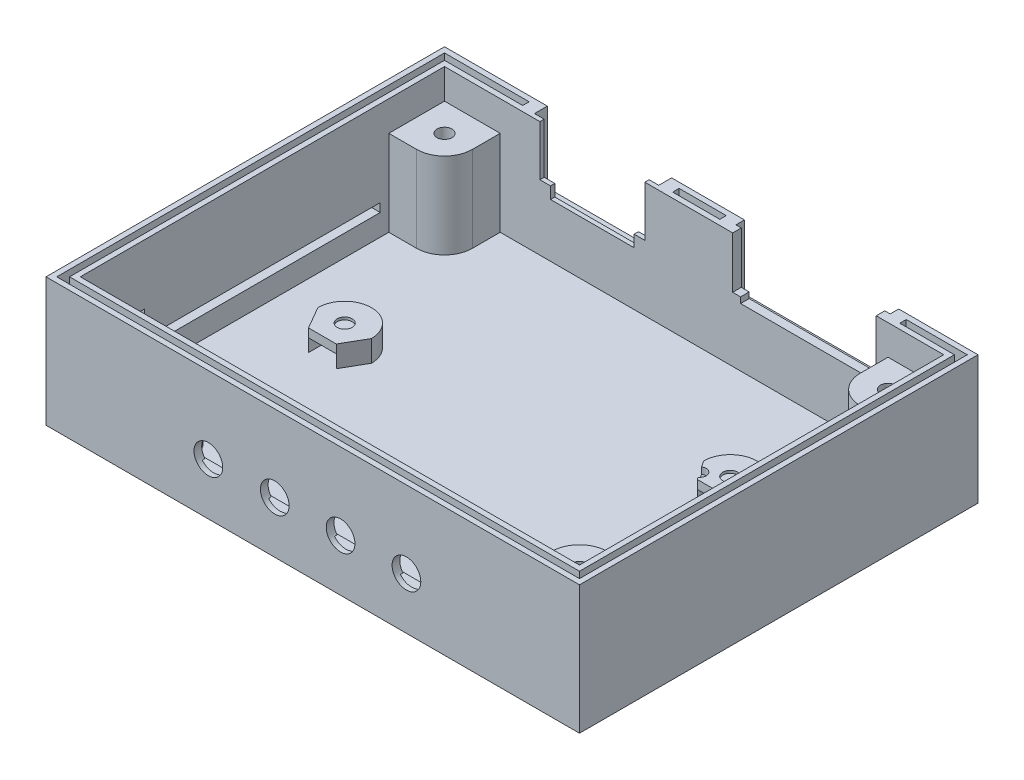
from build123d import *

# Parameters (mm, degrees)
SKETCH_1_W             = 116.5
SKETCH_1_H             = 85
EXTRUDE_1_DEPTH        = 3
EXTRUDE_2_DEPTH        = 3
EXTRUDE_3_DEPTH        = 2
SKETCH_5_W             = 2
SKETCH_5_H             = 5.464101615
SKETCH_5_W_2           = 1.5
SKETCH_5_H_2           = 1.5
CUT_EXTRUDE_1_DEPTH    = 1.5
SKETCH_211_R           = 1.75
CUT_EXTRUDE_17_DEPTH   = 0.6
EXTRUDE_1_2_DEPTH      = 27
EXTRUDE_1_2_DEPTH_BACK = 3
SKETCH_6_W             = 124.5
SKETCH_6_H             = 93
SKETCH_6_W_2           = 116.5
SKETCH_6_H_2           = 85
CUT_EXTRUDE_6_DEPTH    = 3
CUT_EXTRUDE_1_2_DEPTH  = 2
CUT_EXTRUDE_7_REACH    = 114.677
SKETCH_30_R            = 3.35
SKETCH_31_W            = 13.2
SKETCH_31_H            = 7
CUT_EXTRUDE_8_DEPTH    = 2.2
SWEEP_1_PROFILE_R      = 3.85
SWEEP_3_PROFILE_R      = 3.85
SWEEP_4_PROFILE_R      = 3.85
SWEEP_5_PROFILE_R      = 3.85
CUT_EXTRUDE_11_REACH   = 134.599
SKETCH_121_R           = 3.35
SWEEP_6_PROFILE_R      = 3.35
CUT_EXTRUDE_2_DEPTH    = 8
SKETCH_149_W           = 29
SKETCH_149_H           = 16.5
CUT_EXTRUDE_12_DEPTH   = 3
CUT_EXTRUDE_13_DEPTH   = 1
SKETCH_191_W           = 36
SKETCH_191_H           = 15
CUT_EXTRUDE_14_DEPTH   = 2
CUT_EXTRUDE_15_DEPTH   = 2
EXTRUDE_4_DEPTH        = 20
SKETCH_194_R           = 1.75
CUT_EXTRUDE_16_DEPTH   = 10
SKETCH_238_W           = 11
SKETCH_238_H           = 1.5
CUT_EXTRUDE_3_DEPTH    = 3


with BuildPart() as part:
    # Эскиз1 → Extrude 1 (new body)
    with BuildSketch(Plane(origin=(0, 0, 0), x_dir=(1, 0, 0), z_dir=(0, 1, 0))):
        Rectangle(SKETCH_1_W, SKETCH_1_H)
    extrude(amount=EXTRUDE_1_DEPTH)

    # Эскиз3 → Бобышка-Вытянуть2 (add)
    with BuildSketch(Plane(origin=(0, 3, 0), x_dir=(1, 0, 0), z_dir=(0, 1, 0))):
        Polygon((-46.3, -40.5), (-46.3, -42.5), (-42.145299462, -42.5), (-43.3, -40.5), (-43.3, -35.303847577), align=None)
        Polygon((-33.8, -42.5), (-33.8, -40.5), (-36.8, -35.303847577), (-36.8, -40.5), (-37.954700538, -42.5), align=None)
        Polygon((39.2, -40.5), (39.2, -35.303847577), (42.2, -40.5), (42.2, -42.5), (38.045299462, -42.5), align=None)
        with BuildLine():
            Line((-36.8, 1), (-38.425, 3.814582562))
            Line((-38.425, 3.814582562), (-41.675, 3.814582562))
            Line((-41.675, 3.814582562), (-43.3, 1))
            Line((-43.3, 1), (-43.3, -4.196152423))
            Line((-43.3, -4.196152423), (-46.3, 1))
            ThreePointArc((-46.3, 1), (-40.05, 7.25), (-33.8, 1))
            Line((-33.8, 1), (-36.8, -4.196152423))
            Line((-36.8, -4.196152423), (-36.8, 1))
        make_face()
        Polygon((29.7, -40.5), (29.7, -42.5), (33.854700538, -42.5), (32.7, -40.5), (32.7, -35.303847577), align=None)
        with BuildLine():
            Line((39.2, 14.999999964), (37.386138315, 17.696739832))
            Line((37.386138315, 17.696739832), (34.513861685, 17.696739832))
            Line((34.513861685, 17.696739832), (32.7, 14.999999964))
            Line((32.7, 14.999999964), (32.7, 10.539781588))
            Line((32.7, 10.539781588), (29.7, 14.999999964))
            ThreePointArc((29.7, 14.999999964), (35.95, 21.25), (42.2, 14.999999964))
            Line((42.2, 14.999999964), (39.2, 10.539781588))
            Line((39.2, 10.539781588), (39.2, 14.999999964))
        make_face()
    extrude(amount=EXTRUDE_2_DEPTH)

    # Эскиз4 → Бобышка-Вытянуть3 (add)
    with BuildSketch(Plane(origin=(0, 6, 0), x_dir=(1, 0, 0), z_dir=(0, 1, 0))):
        Polygon((-33.8, -40.5), (-36.8, -35.303847577), (-43.3, -35.303847577), (-46.3, -40.5), (-46.3, -42.5), (-33.8, -42.5), align=None)
        with BuildLine():
            Line((-46.3, 1), (-43.3, -4.196152423))
            Line((-43.3, -4.196152423), (-36.8, -4.196152423))
            Line((-36.8, -4.196152423), (-33.8, 1))
            ThreePointArc((-33.8, 1), (-40.05, 7.25), (-46.3, 1))
        make_face()
        with BuildLine():
            Line((29.7, 14.999999964), (32.7, 10.539781588))
            Line((32.7, 10.539781588), (39.2, 10.539781588))
            Line((39.2, 10.539781588), (42.2, 14.999999964))
            ThreePointArc((42.2, 14.999999964), (35.95, 21.249999964), (29.7, 14.999999964))
        make_face()
        Polygon((29.7, -40.5), (29.7, -42.5), (42.2, -42.5), (42.2, -40.5), (39.2, -35.303847577), (32.7, -35.303847577), align=None)
    extrude(amount=EXTRUDE_3_DEPTH)

    # Эскиз5 → Cut-Extrude 1 (cut)
    with BuildSketch(Plane(origin=(0, 8, 0), x_dir=(1, 0, 0), z_dir=(0, 1, 0))):
        with Locations((-34.8, -39.767949192)):
            Rectangle(SKETCH_5_W, SKETCH_5_H)
        with Locations((36.45, -36.053847577)):
            Rectangle(SKETCH_5_W_2, SKETCH_5_H_2)
        with BuildLine():
            Line((30.66558225, 13.564430732), (32.339916158, 11.075132444))
            ThreePointArc((32.339916158, 11.075132444), (32.747398348, 13.156948542), (30.66558225, 13.564430732))
        make_face()
    extrude(amount=-CUT_EXTRUDE_1_DEPTH, mode=Mode.SUBTRACT)

    # Эскиз211 → Вырез-Вытянуть17 (cut)
    with BuildSketch(Plane(origin=(0, 8, 0), x_dir=(1, 0, 0), z_dir=(0, 1, 0))):
        with Locations(Location((-40.05, 1, 0), (0, 0, 270))):
            Circle(SKETCH_211_R)
        with Locations(Location((35.95, 15, 0), (0, 0, 270))):
            Circle(SKETCH_211_R)
        with Locations(Location((35.95, -40.5, 0), (0, 0, 270))):
            Circle(SKETCH_211_R)
        with Locations(Location((-40.05, -40.5, 0), (0, 0, 270))):
            Circle(SKETCH_211_R)
    extrude(amount=-CUT_EXTRUDE_17_DEPTH, mode=Mode.SUBTRACT)

    # Эскиз6 → Extrude 1 2 (add, two sides: drawn at the far end of the back side and taken through both)
    with BuildSketch(Plane(origin=(0, 3, 0), x_dir=(1, 0, 0), z_dir=(0, 1, 0)).offset(-EXTRUDE_1_2_DEPTH_BACK)):
        Rectangle(SKETCH_6_W, SKETCH_6_H)
        Rectangle(SKETCH_6_W_2, SKETCH_6_H_2, mode=Mode.SUBTRACT)
    extrude(amount=EXTRUDE_1_2_DEPTH + EXTRUDE_1_2_DEPTH_BACK)

    # Эскиз29 → Вырез-Вытянуть6 (cut)
    with BuildSketch(Plane(origin=(0, 3, 0), x_dir=(1, 0, 0), z_dir=(0, 1, 0))):
        Polygon((-36.8, -40.5), (-38.425, -37.685417438), (-41.675, -37.685417438), (-43.3, -40.5), (-41.675, -43.314582562), (-38.425, -43.314582562), align=None)
        Polygon((39.2, -40.5), (37.575, -37.685417438), (34.325, -37.685417438), (32.7, -40.5), (34.325, -43.314582562), (37.575, -43.314582562), align=None)
    extrude(amount=CUT_EXTRUDE_6_DEPTH, mode=Mode.SUBTRACT)

    # Эскиз9 → Cut-Extrude 1 2 (cut)
    with BuildSketch(Plane(origin=(0, 8, 0), x_dir=(1, 0, 0), z_dir=(0, 1, 0))):
        Polygon((-58.25, 27.5), (-58.25, -42.5), (46.75, -42.5), (46.75, -45.3), (-61.05, -45.3), (-61.05, 27.5), align=None)
    extrude(amount=CUT_EXTRUDE_1_2_DEPTH, mode=Mode.SUBTRACT)

    # Вырез-Вытянуть7: up to this face of the body (flat: up to its plane)
    cut_extrude_7_end = Plane(part.part.faces().sort_by_distance((0, 15, 46.5))[0])
    # Эскиз30 → Вырез-Вытянуть7 (cut, up to the picked face)
    with BuildSketch(Plane(origin=(0, 0, 42.5), x_dir=(-1, 0, 0), z_dir=(0, 0, -1)), mode=Mode.PRIVATE) as cut_extrude_7_sk1:
        with Locations(Location((24.363, 12.1, 0), (0, 0, 321.180745817))):
            Circle(SKETCH_30_R)
    cut_extrude_7_tool1 = split(extrude(cut_extrude_7_sk1.sketch, amount=-CUT_EXTRUDE_7_REACH, mode=Mode.PRIVATE), bisect_by=cut_extrude_7_end, keep=Keep.BOTH, mode=Mode.PRIVATE)
    # Эскиз30 → Вырез-Вытянуть7 (cut, up to the picked face)
    with BuildSketch(Plane(origin=(0, 0, 42.5), x_dir=(-1, 0, 0), z_dir=(0, 0, -1)), mode=Mode.PRIVATE) as cut_extrude_7_sk2:
        with Locations(Location((8.869, 12.1, 0), (0, 0, 321.180745817))):
            Circle(SKETCH_30_R)
    cut_extrude_7_tool2 = split(extrude(cut_extrude_7_sk2.sketch, amount=-CUT_EXTRUDE_7_REACH, mode=Mode.PRIVATE), bisect_by=cut_extrude_7_end, keep=Keep.BOTH, mode=Mode.PRIVATE)
    # Эскиз30 → Вырез-Вытянуть7 (cut, up to the picked face)
    with BuildSketch(Plane(origin=(0, 0, 42.5), x_dir=(-1, 0, 0), z_dir=(0, 0, -1)), mode=Mode.PRIVATE) as cut_extrude_7_sk3:
        with Locations(Location((-6.498, 12.1, 0), (0, 0, 321.180745817))):
            Circle(SKETCH_30_R)
    cut_extrude_7_tool3 = split(extrude(cut_extrude_7_sk3.sketch, amount=-CUT_EXTRUDE_7_REACH, mode=Mode.PRIVATE), bisect_by=cut_extrude_7_end, keep=Keep.BOTH, mode=Mode.PRIVATE)
    # Эскиз30 → Вырез-Вытянуть7 (cut, up to the picked face)
    with BuildSketch(Plane(origin=(0, 0, 42.5), x_dir=(-1, 0, 0), z_dir=(0, 0, -1)), mode=Mode.PRIVATE) as cut_extrude_7_sk4:
        with Locations(Location((-21.865, 12.1, 0), (0, 0, 321.180745817))):
            Circle(SKETCH_30_R)
    cut_extrude_7_tool4 = split(extrude(cut_extrude_7_sk4.sketch, amount=-CUT_EXTRUDE_7_REACH, mode=Mode.PRIVATE), bisect_by=cut_extrude_7_end, keep=Keep.BOTH, mode=Mode.PRIVATE)
    add(cut_extrude_7_tool1.solids().sort_by(Axis((-24.363, 12.1, 42.5), (0, 0, 1)))[0], mode=Mode.SUBTRACT)
    add(cut_extrude_7_tool2.solids().sort_by(Axis((-8.869, 12.1, 42.5), (0, 0, 1)))[0], mode=Mode.SUBTRACT)
    add(cut_extrude_7_tool3.solids().sort_by(Axis((6.498, 12.1, 42.5), (0, 0, 1)))[0], mode=Mode.SUBTRACT)
    add(cut_extrude_7_tool4.solids().sort_by(Axis((21.865, 12.1, 42.5), (0, 0, 1)))[0], mode=Mode.SUBTRACT)

    # Эскиз31 → Вырез-Вытянуть8 (cut)
    with BuildSketch(Plane(origin=(0, 0, 42.5), x_dir=(-1, 0, 0), z_dir=(0, 0, -1))):
        with Locations((24.363, 12.1)):
            Rectangle(SKETCH_31_W, SKETCH_31_H)
        with Locations((8.869, 12.1)):
            Rectangle(SKETCH_31_W, SKETCH_31_H)
        with Locations((-6.498, 12.1)):
            Rectangle(SKETCH_31_W, SKETCH_31_H)
        with Locations((-21.865, 12.1)):
            Rectangle(SKETCH_31_W, SKETCH_31_H)
    extrude(amount=-CUT_EXTRUDE_8_DEPTH, mode=Mode.SUBTRACT)

    # Вырез-По траектории1: sweep along a curve in space
    with BuildLine() as sweep_1_path:
        Line((-24.363, 12.1, 44.57), (-18.462212018, 12.1, 34.349535411))
    # Вырез-По траектории1 profile (on start of the path) → Вырез-По траектории1 (sweep, cut)
    with BuildSketch(Plane(origin=(-24.363, 12.1, 44.57), x_dir=(-0.8660254037844366, 0, -0.5000000000000037), z_dir=(0.5000000000000037, 0, -0.8660254037844366))):
        Circle(SWEEP_1_PROFILE_R)
    sweep(path=sweep_1_path.line, mode=Mode.SUBTRACT)

    # Вырез-По траектории3: sweep along a curve in space
    with BuildLine() as sweep_3_path:
        add(Edge.make_bspline(
            [(-8.869, 12.1, 44.57), (-2.482209352, 12.1, 33.507754101)],
            knots=[0, 0, 1, 1], degree=1))
    # Вырез-По траектории3 profile (on start of the path) → Вырез-По траектории3 (sweep, cut)
    with BuildSketch(Plane(origin=(-8.869, 12.1, 44.57), x_dir=(-0.8660254037844368, 0, -0.5000000000000033), z_dir=(0.5000000000000033, 0, -0.8660254037844368))):
        Circle(SWEEP_3_PROFILE_R)
    sweep(path=sweep_3_path.line, mode=Mode.SUBTRACT)

    # Вырез-По траектории4: sweep along a curve in space
    with BuildLine() as sweep_4_path:
        add(Edge.make_bspline(
            [(6.498, 12.1, 44.57), (11.45564145, 12.1, 35.983113122)],
            knots=[0, 0, 1, 1], degree=1))
    # Вырез-По траектории4 profile (on start of the path) → Вырез-По траектории4 (sweep, cut)
    with BuildSketch(Plane(origin=(6.498, 12.1, 44.57), x_dir=(-0.8660254037844364, 0, -0.5000000000000039), z_dir=(0.500000000000004, 0, -0.8660254037844365))):
        Circle(SWEEP_4_PROFILE_R)
    sweep(path=sweep_4_path.line, mode=Mode.SUBTRACT)

    # Вырез-По траектории5: sweep along a curve in space
    with BuildLine() as sweep_5_path:
        add(Edge.make_bspline(
            [(21.865, 12.1, 44.57), (26.146922219, 12.1, 37.153493162)],
            knots=[0, 0, 1, 1], degree=1))
    # Вырез-По траектории5 profile (on start of the path) → Вырез-По траектории5 (sweep, cut)
    with BuildSketch(Plane(origin=(21.865, 12.1, 44.57), x_dir=(-0.8660254037844364, 0, -0.500000000000004), z_dir=(0.500000000000004, 0, -0.8660254037844364))):
        Circle(SWEEP_5_PROFILE_R)
    sweep(path=sweep_5_path.line, mode=Mode.SUBTRACT)

    # Вырез-Вытянуть11: up to this face of the body (flat: up to its plane)
    cut_extrude_11_end = Plane(part.part.faces().sort_by_distance((-62.25, 15, 0))[0])
    # Эскиз121 → Вырез-Вытянуть11 (cut, up to the picked face)
    with BuildSketch(Plane(origin=(-58.25, 0, 0), x_dir=(0, 0, -1), z_dir=(1, 0, 0)), mode=Mode.PRIVATE) as cut_extrude_11_sk1:
        with Locations(Location((-38.102, 12.1, 0), (0, 0, 321.180745817))):
            Circle(SKETCH_121_R)
    cut_extrude_11_tool1 = split(extrude(cut_extrude_11_sk1.sketch, amount=-CUT_EXTRUDE_11_REACH, mode=Mode.PRIVATE), bisect_by=cut_extrude_11_end, keep=Keep.BOTH, mode=Mode.PRIVATE)
    add(cut_extrude_11_tool1.solids().sort_by(Axis((-58.25, 12.1, 38.102), (-1, 0, 0)))[0], mode=Mode.SUBTRACT)

    # Вырез-По траектории6: sweep along a curve in space
    with BuildLine() as sweep_6_path:
        Line((-60.32, 12.1, 38.102), (-47.329618943, 12.1, 30.602))
    # Вырез-По траектории6 profile (on start of the path) → Вырез-По траектории6 (sweep, cut)
    with BuildSketch(Plane(origin=(-60.32, 12.1, 38.102), x_dir=(0.4999999999999952, 0, 0.8660254037844414), z_dir=(0.8660254037844414, 0, -0.4999999999999952))):
        Circle(SWEEP_6_PROFILE_R)
    sweep(path=sweep_6_path.line, mode=Mode.SUBTRACT)

    # Эскиз143 → Вырез-Вытянуть-Тонкостенный2 (cut)
    with BuildSketch(Plane(origin=(0, 8, 0), x_dir=(1, 0, 0), z_dir=(0, 1, 0))):
        Polygon((-46.25, -42.5), (-58.25, -42.5), (-58.25, -27.5), (-60.25, -27.5), (-60.25, -44.5), (-46.25, -44.5), align=None)
    extrude(amount=CUT_EXTRUDE_2_DEPTH, mode=Mode.SUBTRACT)

    # Эскиз149 → Вырез-Вытянуть12 (cut)
    with BuildSketch(Plane(origin=(0, 0, -46.5), x_dir=(-1, 0, 0), z_dir=(0, 0, -1))):
        with Locations((23.75, 21.75)):
            Rectangle(SKETCH_149_W, SKETCH_149_H)
    extrude(amount=-CUT_EXTRUDE_12_DEPTH, mode=Mode.SUBTRACT)

    # Эскиз150 → Вырез-Вытянуть13 (cut)
    with BuildSketch(Plane(origin=(0, 0, -43.5), x_dir=(-1, 0, 0), z_dir=(0, 0, -1))):
        Polygon((11.5, 18.25), (14, 18.25), (14, 15.5), (33.5, 15.5), (33.5, 18.25), (36, 18.25), (36, 30), (11.5, 30), align=None)
    extrude(amount=-CUT_EXTRUDE_13_DEPTH, mode=Mode.SUBTRACT)

    # Эскиз191 → Вырез-Вытянуть14 (cut)
    with BuildSketch(Plane(origin=(0, 0, -46.5), x_dir=(-1, 0, 0), z_dir=(0, 0, -1))):
        with Locations((-25.75, 22.5)):
            Rectangle(SKETCH_191_W, SKETCH_191_H)
    extrude(amount=-CUT_EXTRUDE_14_DEPTH, mode=Mode.SUBTRACT)

    # Эскиз192 → Вырез-Вытянуть15 (cut)
    with BuildSketch(Plane(origin=(0, 0, -44.5), x_dir=(-1, 0, 0), z_dir=(0, 0, -1))):
        Polygon((-42.5, 30), (-42.5, 18), (-40.65, 18), (-40.65, 16.65), (-10.85, 16.65), (-10.85, 18), (-9, 18), (-9, 30), align=None)
    extrude(amount=-CUT_EXTRUDE_15_DEPTH, mode=Mode.SUBTRACT)

    # Эскиз193 → Бобышка-Вытянуть4 (add)
    with BuildSketch(Plane(origin=(0, 3, 0), x_dir=(1, 0, 0), z_dir=(0, 1, 0))):
        with BuildLine():
            Line((45.25, -42.5), (58.25, -42.5))
            Line((58.25, -42.5), (58.25, -29.5))
            Line((58.25, -29.5), (51.75, -29.5))
            ThreePointArc((51.75, -29.5), (47.153805922, -31.403805922), (45.25, -36))
            Line((45.25, -36), (45.25, -42.5))
        make_face()
        with BuildLine():
            Line((-58.25, 29.5), (-51.75, 29.5))
            ThreePointArc((-51.75, 29.5), (-47.153805922, 31.403805922), (-45.25, 36))
            Line((-45.25, 36), (-45.25, 42.5))
            Line((-45.25, 42.5), (-58.25, 42.5))
            Line((-58.25, 42.5), (-58.25, 29.5))
        make_face()
        with BuildLine():
            Line((45.25, 42.5), (45.25, 36))
            ThreePointArc((45.25, 36), (47.153805922, 31.403805922), (51.75, 29.5))
            Line((51.75, 29.5), (58.25, 29.5))
            Line((58.25, 29.5), (58.25, 42.5))
            Line((58.25, 42.5), (45.25, 42.5))
        make_face()
    extrude(amount=EXTRUDE_4_DEPTH)

    # Эскиз194 → Вырез-Вытянуть16 (cut)
    with BuildSketch(Plane(origin=(0, 23, 0), x_dir=(1, 0, 0), z_dir=(0, 1, 0))):
        with Locations(Location((-51.75, 36, 0), (0, 0, 270))):
            Circle(SKETCH_194_R)
        with Locations(Location((51.75, 36, 0), (0, 0, 270))):
            Circle(SKETCH_194_R)
        with Locations(Location((51.75, -36, 0), (0, 0, 270))):
            Circle(SKETCH_194_R)
    extrude(amount=-CUT_EXTRUDE_16_DEPTH, mode=Mode.SUBTRACT)

    # Эскиз238 → Вырез-Вытянуть-Тонкостенный3 (cut)
    with BuildSketch(Plane(origin=(0, 30, 0), x_dir=(1, 0, 0), z_dir=(0, 1, 0))):
        Polygon((-41.25, 45.25), (-61, 45.25), (-61, -45.25), (61, -45.25), (61, 45.25), (46.75, 45.25), (46.75, 43.75), (59.5, 43.75), (59.5, -43.75), (-59.5, -43.75), (-59.5, 43.75), (-41.25, 43.75), align=None)
        with Locations((-0.75, 44.5)):
            Rectangle(SKETCH_238_W, SKETCH_238_H)
    extrude(amount=-CUT_EXTRUDE_3_DEPTH, mode=Mode.SUBTRACT)


solid = part.part
